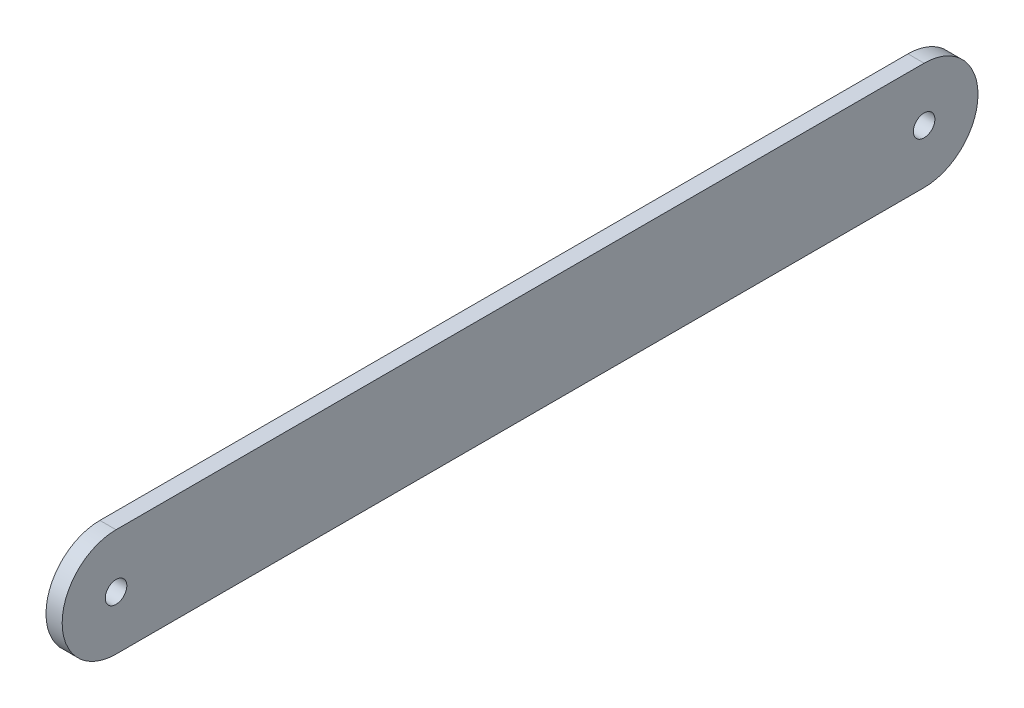
from build123d import *

# Parameters (mm, degrees)
SKETCH1_R           = 2
BOSS_EXTRUDE1_DEPTH = 3


with BuildPart() as part:
    # Sketch1 → Boss-Extrude1 (new body)
    with BuildSketch(Plane(origin=(0, 0, 0), x_dir=(0, 0, -1), z_dir=(1, 0, 0))):
        with BuildLine():
            Line((-75, 10), (75, 10))
            ThreePointArc((75, 10), (85, 0), (75, -10))
            Line((75, -10), (-75, -10))
            ThreePointArc((-75, -10), (-85, 0), (-75, 10))
        make_face()
        with Locations((-75, 0)):
            Circle(SKETCH1_R, mode=Mode.SUBTRACT)
        with Locations((75, 0)):
            Circle(SKETCH1_R, mode=Mode.SUBTRACT)
    extrude(amount=BOSS_EXTRUDE1_DEPTH)


solid = part.part
